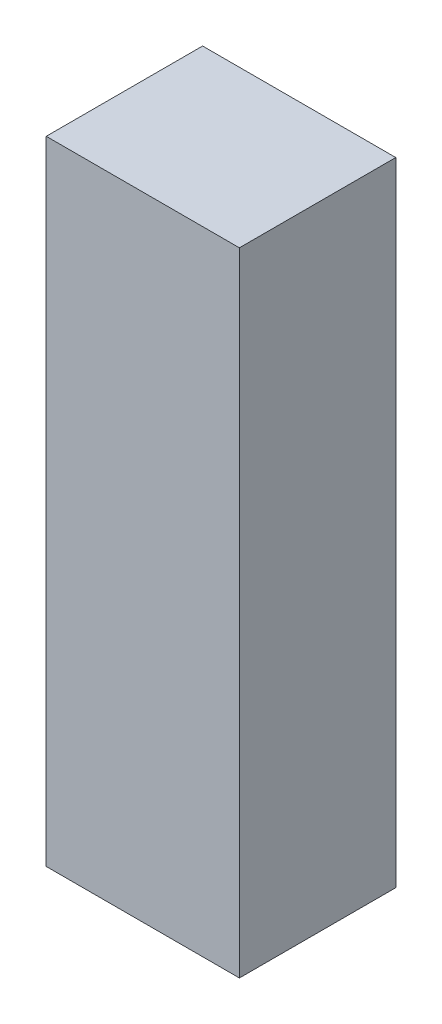
from build123d import *

# Parameters (mm, degrees)
SKETCH1_W           = 84
SKETCH1_H           = 68
BOSS_EXTRUDE1_DEPTH = 275


with BuildPart() as part:
    # Sketch1 → Boss-Extrude1 (new body)
    with BuildSketch(Plane(origin=(0, 0, 0), x_dir=(1, 0, 0), z_dir=(0, 1, 0))):
        with Locations((-17.746666667, -9.406666667)):
            Rectangle(SKETCH1_W, SKETCH1_H)
    extrude(amount=BOSS_EXTRUDE1_DEPTH)


solid = part.part
